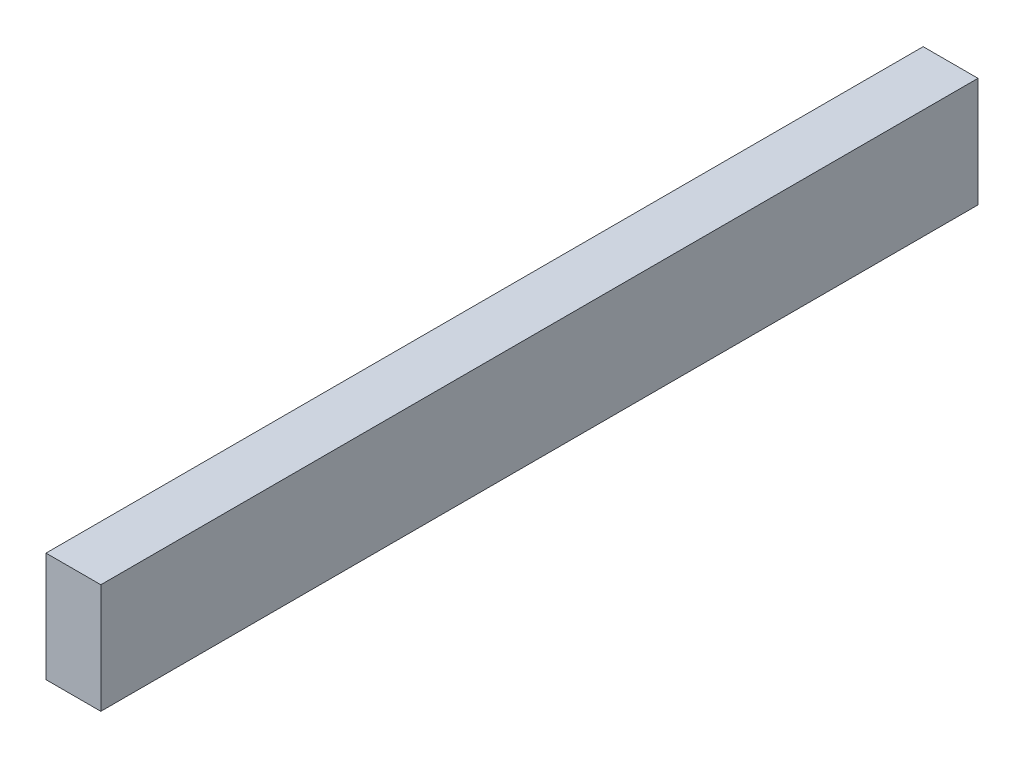
from build123d import *

# Parameters (mm, degrees)
SKETCH1_W           = 50.8
SKETCH1_H           = 101.6
BOSS_EXTRUDE1_DEPTH = 812.8


with BuildPart() as part:
    # Sketch1 → Boss-Extrude1 (new body)
    with BuildSketch(Plane.XY):
        Rectangle(SKETCH1_W, SKETCH1_H)
    extrude(amount=BOSS_EXTRUDE1_DEPTH)


solid = part.part
